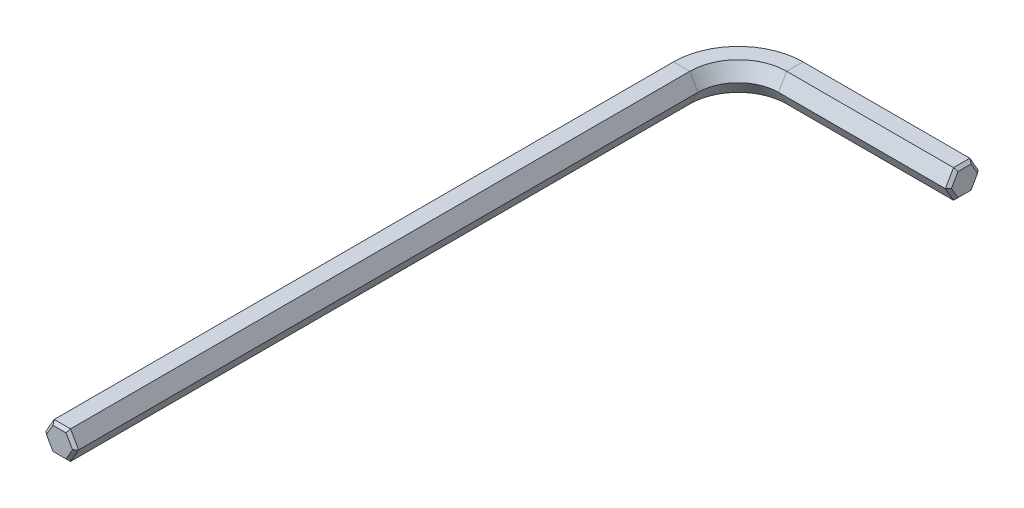
from build123d import *

# Parameters (mm, degrees)
CHAMFER1_SIZE = 0.25
CHAMFER2_SIZE = 0.25


with BuildPart() as part:
    # Sweep1: sweep along a path in Sketch2
    with BuildLine(Plane(origin=(0, 0, 0), x_dir=(1, 0, 0), z_dir=(0, 1, 0))) as sweep1_path:
        Line((0, 0), (0, 55))
        ThreePointArc((0, 55), (1.464466094, 58.535533906), (5, 60))
        Line((5, 60), (20, 60))
    # Sketch1 → Sweep1 (sweep)
    with BuildSketch(Plane.XY):
        Polygon((0.721687836, 1.25), (-0.721687836, 1.25), (-1.443375673, 0), (-0.721687836, -1.25), (0.721687836, -1.25), (1.443375673, 0), align=None)
    sweep(path=sweep1_path.line)

    # Chamfer1
    chamfer1_edges = [part.edges().sort_by_distance(p)[0] for p in [
        (20, -1.25, -60),
        (20, -0.625, -58.917468245),
        (20, 0.625, -58.917468245),
        (20, 1.25, -60),
        (20, 0.625, -61.082531755),
        (20, -0.625, -61.082531755),
    ]]
    chamfer(chamfer1_edges, length=CHAMFER1_SIZE)

    # Chamfer2
    chamfer2_edges = [part.edges().sort_by_distance(p)[0] for p in [
        (0, 1.25, 0),
        (-1.082531755, 0.625, 0),
        (-1.082531755, -0.625, 0),
        (0, -1.25, 0),
        (1.082531755, -0.625, 0),
        (1.082531755, 0.625, 0),
    ]]
    chamfer(chamfer2_edges, length=CHAMFER2_SIZE)


solid = part.part
